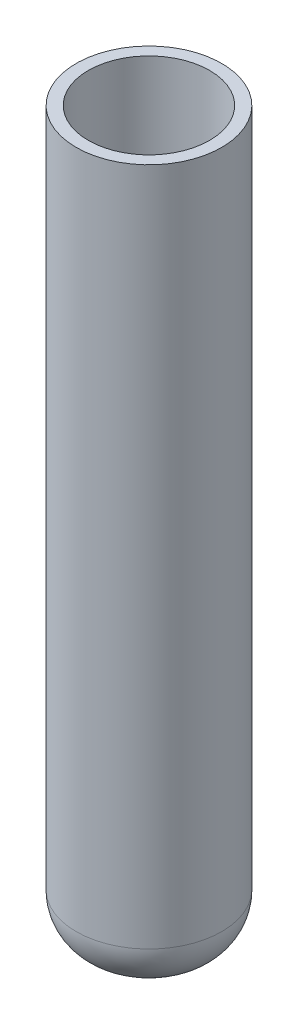
from build123d import *

# Parameters (mm, degrees)
SKETCH_1_R      = 3
EXTRUDE_1_DEPTH = 30
FILLET_1_R      = 2
SHELL_1_T       = -0.5


with BuildPart() as part:
    # 草图1 → 凸台-拉伸1 (new body)
    with BuildSketch(Plane(origin=(0, 0, 0), x_dir=(1, 0, 0), z_dir=(0, 1, 0))):
        with Locations(Location((0, 0, 0), (0, 0, 270))):
            Circle(SKETCH_1_R)
    extrude(amount=EXTRUDE_1_DEPTH)

    # 圆角1
    fillet_1_edges = [part.edges().sort_by_distance(p)[0] for p in [
        (0, 0, -3),
    ]]
    fillet(fillet_1_edges, radius=FILLET_1_R)

    # 抽壳1
    shell_1_openings = [part.faces().sort_by_distance(p)[0] for p in [
        (0, 30, 0),
    ]]
    offset(amount=SHELL_1_T, openings=shell_1_openings, kind=Kind.INTERSECTION)


solid = part.part
